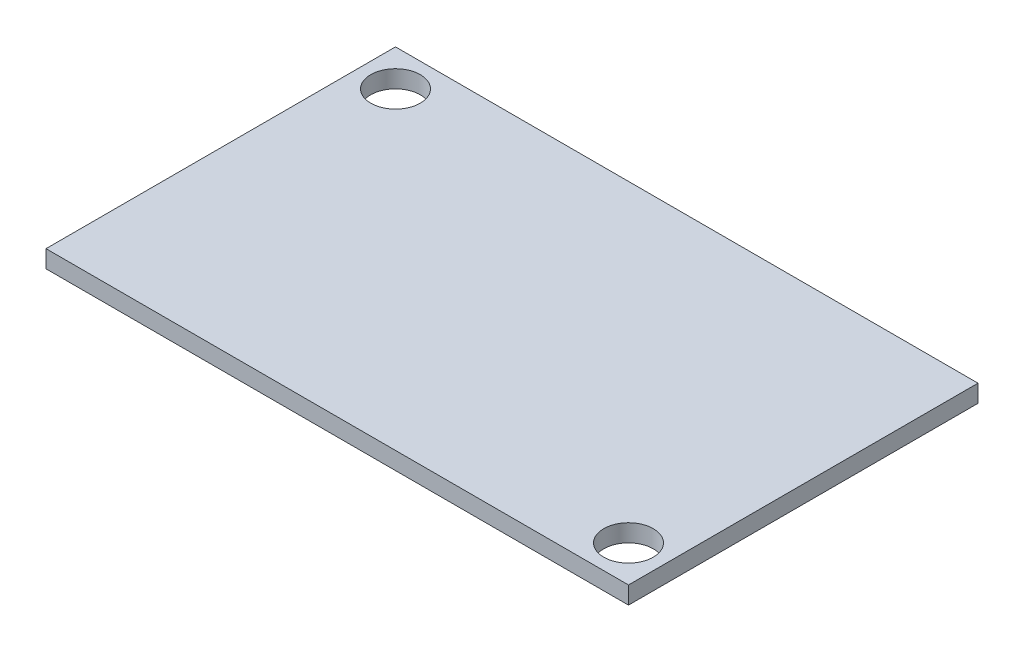
from build123d import *

# Parameters (mm, degrees)
SKETCH1_W            = 40
SKETCH1_H            = 24
BOSS_EXTRUDE1_DEPTH  = 1.2
M3_CLEARANCE_HOLE1_D = 3.4


with BuildPart() as part:
    # Sketch1 → Boss-Extrude1 (new body)
    with BuildSketch(Plane(origin=(0, 0, 0), x_dir=(1, 0, 0), z_dir=(0, 1, 0))):
        with Locations((-4.777491725, -10.641351661)):
            Rectangle(SKETCH1_W, SKETCH1_H)
    extrude(amount=BOSS_EXTRUDE1_DEPTH)

    # M3 Clearance Hole1 (through all)
    with Locations(Plane(origin=(-22.277491725, 1.2, 1.141351661), x_dir=(0, 0, 1), z_dir=(0, 1, 0))):
        with Locations((0, 0), (19, 35)):
            Hole(M3_CLEARANCE_HOLE1_D / 2)


solid = part.part
